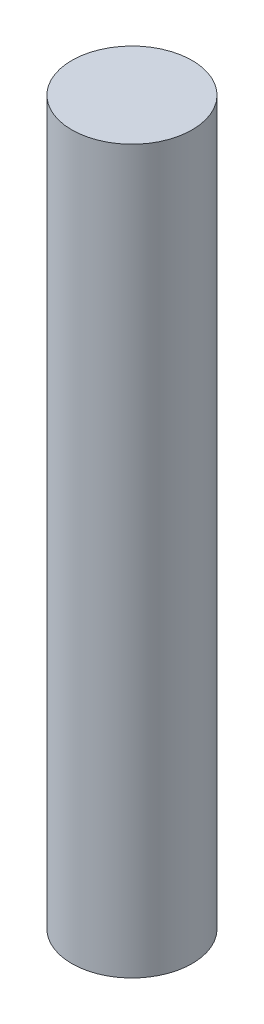
from build123d import *

# Parameters (mm, degrees)
SKETCH1_R           = 2.116666667
BOSS_EXTRUDE1_DEPTH = 25.4


with BuildPart() as part:
    # Sketch1 → Boss-Extrude1 (new body)
    with BuildSketch(Plane(origin=(0, 0, 0), x_dir=(1, 0, 0), z_dir=(0, 1, 0))):
        with Locations(Location((0, 0, 0), (0, 0, 270))):
            Circle(SKETCH1_R)
    extrude(amount=BOSS_EXTRUDE1_DEPTH)


solid = part.part
